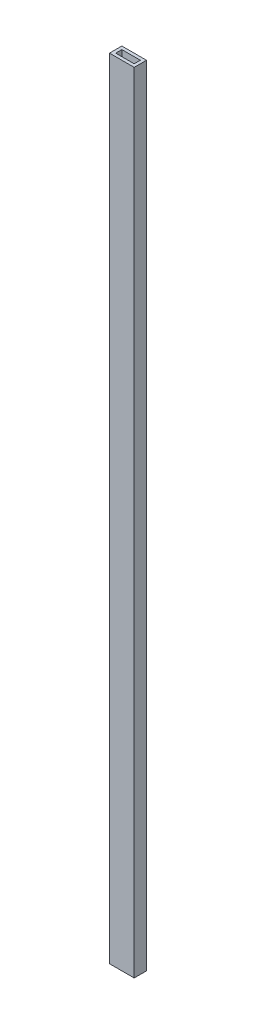
from build123d import *

# Parameters (mm, degrees)
SKETCH1_W           = 25.4
SKETCH1_H           = 12.7
SKETCH1_W_2         = 19.05
SKETCH1_H_2         = 6.35
EXTRUDE_THIN1_DEPTH = 812.8


with BuildPart() as part:
    # Sketch1 → Extrude-Thin1 (new body)
    with BuildSketch(Plane(origin=(0, 0, 0), x_dir=(1, 0, 0), z_dir=(0, 1, 0))):
        with Locations((12.7, 6.35)):
            Rectangle(SKETCH1_W, SKETCH1_H)
        with Locations((12.7, 6.35)):
            Rectangle(SKETCH1_W_2, SKETCH1_H_2, mode=Mode.SUBTRACT)
    extrude(amount=EXTRUDE_THIN1_DEPTH)


solid = part.part
